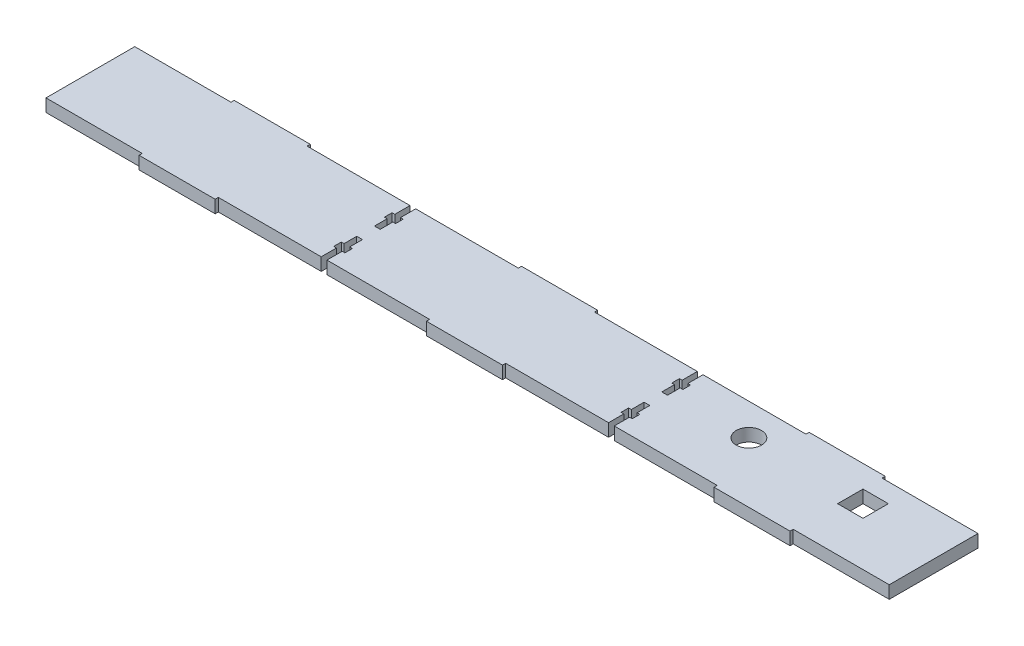
from build123d import *

# Parameters (mm, degrees)
SKETCH1_W           = 428.625
SKETCH1_H           = 47.625
BOSS_EXTRUDE1_DEPTH = 6.35
SKETCH2_W           = 51.2445
SKETCH2_H           = 1.5875
SKETCH2_W_2         = 51.3715
CUT_EXTRUDE4_DEPTH  = 6.35
SKETCH4_W           = 3.175
SKETCH4_H           = 44.45
CUT_EXTRUDE5_DEPTH  = 6.35
SKETCH3_R           = 6.35
SKETCH3_W           = 12.7
SKETCH3_H           = 12.7
CUT_EXTRUDE6_DEPTH  = 6.35


with BuildPart() as part:
    # Sketch1 → Boss-Extrude1 (new body)
    with BuildSketch(Plane(origin=(0, 0, 0), x_dir=(1, 0, 0), z_dir=(0, 1, 0))):
        Rectangle(SKETCH1_W, SKETCH1_H)
    extrude(amount=BOSS_EXTRUDE1_DEPTH)

    # Sketch2 → Cut-Extrude4 (cut)
    with BuildSketch(Plane.XZ):
        Polygon((-124.841, -22.225), (-124.841, -23.8125), (-19.05, -23.8125), (-19.05, -22.225), (-70.45325, -22.225), (-73.31075, -22.225), align=None)
        with Locations((188.69025, 23.01875)):
            Rectangle(SKETCH2_W, SKETCH2_H)
        Polygon((19.05, 23.8125), (19.05, 22.225), (70.58025, 22.225), (73.43775, 22.225), (124.968, 22.225), (124.968, 23.8125), align=None)
        Polygon((-124.841, 22.225), (-73.31075, 22.225), (-70.45325, 22.225), (-19.05, 22.225), (-19.05, 23.8125), (-124.841, 23.8125), align=None)
        Polygon((19.05, -22.225), (19.05, -23.8125), (124.968, -23.8125), (124.968, -22.225), (73.43775, -22.225), (70.58025, -22.225), align=None)
        with Locations((188.69025, -23.01875)):
            Rectangle(SKETCH2_W, SKETCH2_H)
        with Locations((-188.62675, 23.01875)):
            Rectangle(SKETCH2_W_2, SKETCH2_H)
        with Locations((-188.62675, -23.01875)):
            Rectangle(SKETCH2_W_2, SKETCH2_H)
        Polygon((-70.45325, -4.445), (-70.45325, -10.795), (-69.088, -10.795), (-69.088, -14.605), (-70.45325, -14.605), (-70.45325, -22.225), (-73.31075, -22.225), (-73.31075, -14.605), (-74.676, -14.605), (-74.676, -10.795), (-73.31075, -10.795), (-73.31075, -4.445), align=None)
        Polygon((-70.45325, 4.445), (-73.31075, 4.445), (-73.31075, 10.795), (-74.676, 10.795), (-74.676, 14.605), (-73.31075, 14.605), (-73.31075, 22.225), (-70.45325, 22.225), (-70.45325, 14.605), (-69.088, 14.605), (-69.088, 10.795), (-70.45325, 10.795), align=None)
        Polygon((73.43775, 4.445), (70.58025, 4.445), (70.58025, 10.795), (69.215, 10.795), (69.215, 14.605), (70.58025, 14.605), (70.58025, 22.225), (73.43775, 22.225), (73.43775, 14.605), (74.803, 14.605), (74.803, 10.795), (73.43775, 10.795), align=None)
        Polygon((73.43775, -4.445), (73.43775, -10.795), (74.803, -10.795), (74.803, -14.605), (73.43775, -14.605), (73.43775, -22.225), (70.58025, -22.225), (70.58025, -14.605), (69.215, -14.605), (69.215, -10.795), (70.58025, -10.795), (70.58025, -4.445), align=None)
    extrude(amount=-CUT_EXTRUDE4_DEPTH, mode=Mode.SUBTRACT)

    # Sketch4 → Cut-Extrude5 (cut)
    with BuildSketch(Plane.XZ):
        with Locations((-212.725, 0)):
            Rectangle(SKETCH4_W, SKETCH4_H)
        with Locations((212.725, 0)):
            Rectangle(SKETCH4_W, SKETCH4_H)
    extrude(amount=-CUT_EXTRUDE5_DEPTH, mode=Mode.SUBTRACT)

    # Sketch3 → Cut-Extrude6 (cut)
    with BuildSketch(Plane.XZ):
        with Locations(Location((112.268, -6.35, 0), (0, 0, 270))):
            Circle(SKETCH3_R)
        with Locations((169.418, -6.35)):
            Rectangle(SKETCH3_W, SKETCH3_H)
    extrude(amount=-CUT_EXTRUDE6_DEPTH, mode=Mode.SUBTRACT)


solid = part.part
